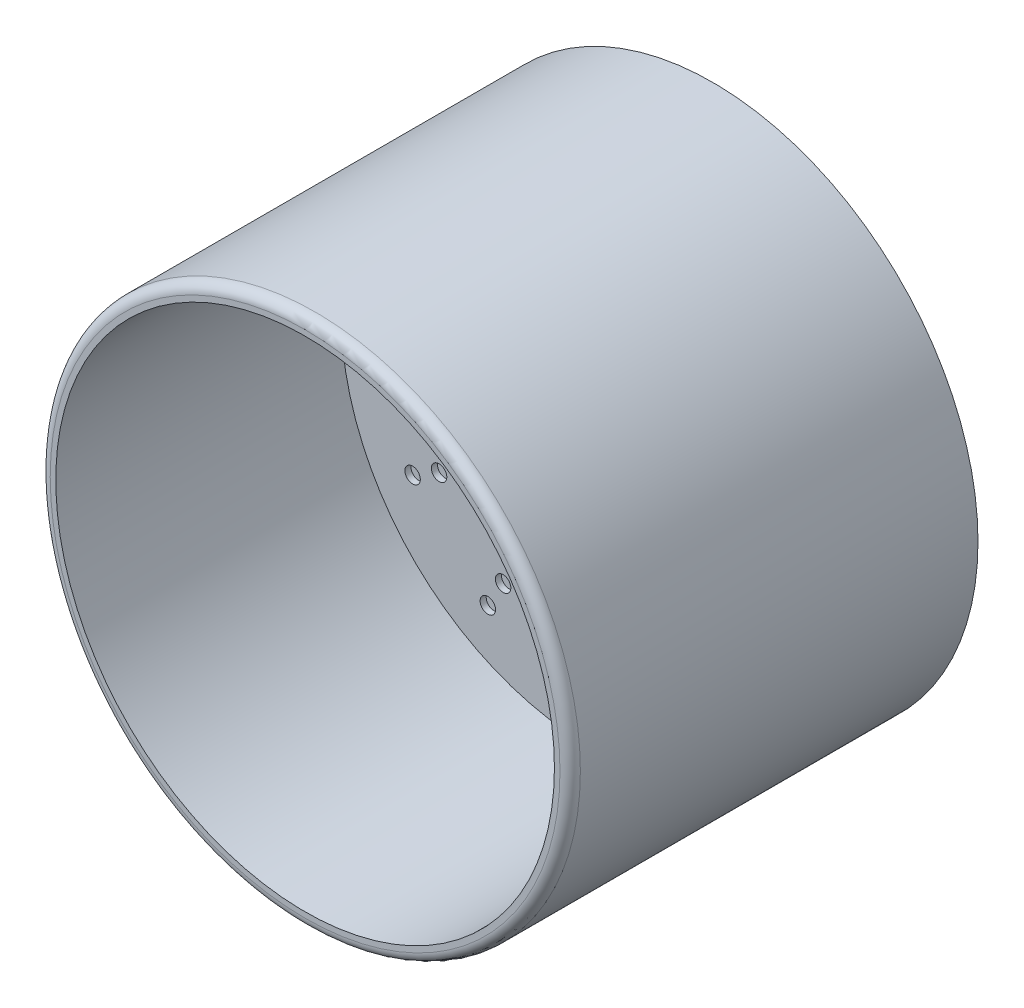
from build123d import *

# Parameters (mm, degrees)
SKETCH1_R           = 13
BOSS_EXTRUDE1_DEPTH = 20
SKETCH2_R           = 12.227815656
CUT_EXTRUDE1_DEPTH  = 14
SKETCH3_R           = 0.378353797
CUT_EXTRUDE2_DEPTH  = 0.3
FILLET1_R           = 0.5


with BuildPart() as part:
    # Sketch1 → Boss-Extrude1 (new body)
    with BuildSketch(Plane.XY):
        Circle(SKETCH1_R)
    extrude(amount=BOSS_EXTRUDE1_DEPTH)

    # Sketch2 → Cut-Extrude1 (cut)
    with BuildSketch(Plane.XY.offset(20)):
        Circle(SKETCH2_R)
    extrude(amount=-CUT_EXTRUDE1_DEPTH, mode=Mode.SUBTRACT)

    # Sketch3 → Cut-Extrude2 (cut)
    with BuildSketch(Plane.XY.offset(6)):
        with Locations((0, 10.077969325)):
            Circle(SKETCH3_R)
        with Locations((0, 8.577969325)):
            Circle(SKETCH3_R)
        with Locations((0, 7.077969325)):
            Circle(SKETCH3_R)
        with Locations((0, 5.577969325)):
            Circle(SKETCH3_R)
        with Locations((0, 4.077969325)):
            Circle(SKETCH3_R)
        with Locations((0, 2.577969325)):
            Circle(SKETCH3_R)
        with Locations((5.038984662, 8.727777454)):
            Circle(SKETCH3_R)
        with Locations((4.288984662, 7.428739348)):
            Circle(SKETCH3_R)
        with Locations((3.538984662, 6.129701243)):
            Circle(SKETCH3_R)
        with Locations((2.788984662, 4.830663137)):
            Circle(SKETCH3_R)
        with Locations((2.038984662, 3.531625031)):
            Circle(SKETCH3_R)
        with Locations((1.288984662, 2.232586926)):
            Circle(SKETCH3_R)
        with Locations((8.727777454, 5.038984662)):
            Circle(SKETCH3_R)
        with Locations((7.428739348, 4.288984662)):
            Circle(SKETCH3_R)
        with Locations((6.129701243, 3.538984662)):
            Circle(SKETCH3_R)
        with Locations((4.830663137, 2.788984662)):
            Circle(SKETCH3_R)
        with Locations((3.531625031, 2.038984662)):
            Circle(SKETCH3_R)
        with Locations((2.232586926, 1.288984662)):
            Circle(SKETCH3_R)
        with Locations((10.077969325, 0)):
            Circle(SKETCH3_R)
        with Locations((8.577969325, 0)):
            Circle(SKETCH3_R)
        with Locations((7.077969325, 0)):
            Circle(SKETCH3_R)
        with Locations((5.577969325, 0)):
            Circle(SKETCH3_R)
        with Locations((4.077969325, 0)):
            Circle(SKETCH3_R)
        with Locations((2.577969325, 0)):
            Circle(SKETCH3_R)
        with Locations((8.727777454, -5.038984662)):
            Circle(SKETCH3_R)
        with Locations((7.428739348, -4.288984662)):
            Circle(SKETCH3_R)
        with Locations((6.129701243, -3.538984662)):
            Circle(SKETCH3_R)
        with Locations((4.830663137, -2.788984662)):
            Circle(SKETCH3_R)
        with Locations((3.531625031, -2.038984662)):
            Circle(SKETCH3_R)
        with Locations((2.232586926, -1.288984662)):
            Circle(SKETCH3_R)
        with Locations((5.038984662, -8.727777454)):
            Circle(SKETCH3_R)
        with Locations((4.288984662, -7.428739348)):
            Circle(SKETCH3_R)
        with Locations((3.538984662, -6.129701243)):
            Circle(SKETCH3_R)
        with Locations((2.788984662, -4.830663137)):
            Circle(SKETCH3_R)
        with Locations((2.038984662, -3.531625031)):
            Circle(SKETCH3_R)
        with Locations((1.288984662, -2.232586926)):
            Circle(SKETCH3_R)
        with Locations((0, -10.077969325)):
            Circle(SKETCH3_R)
        with Locations((0, -8.577969325)):
            Circle(SKETCH3_R)
        with Locations((0, -7.077969325)):
            Circle(SKETCH3_R)
        with Locations((0, -5.577969325)):
            Circle(SKETCH3_R)
        with Locations((0, -4.077969325)):
            Circle(SKETCH3_R)
        with Locations((0, -2.577969325)):
            Circle(SKETCH3_R)
        with Locations((-5.038984662, -8.727777454)):
            Circle(SKETCH3_R)
        with Locations((-4.288984662, -7.428739348)):
            Circle(SKETCH3_R)
        with Locations((-3.538984662, -6.129701243)):
            Circle(SKETCH3_R)
        with Locations((-2.788984662, -4.830663137)):
            Circle(SKETCH3_R)
        with Locations((-2.038984662, -3.531625031)):
            Circle(SKETCH3_R)
        with Locations((-1.288984662, -2.232586926)):
            Circle(SKETCH3_R)
        with Locations((-8.727777454, -5.038984662)):
            Circle(SKETCH3_R)
        with Locations((-7.428739348, -4.288984662)):
            Circle(SKETCH3_R)
        with Locations((-6.129701243, -3.538984662)):
            Circle(SKETCH3_R)
        with Locations((-4.830663137, -2.788984662)):
            Circle(SKETCH3_R)
        with Locations((-3.531625031, -2.038984662)):
            Circle(SKETCH3_R)
        with Locations((-2.232586926, -1.288984662)):
            Circle(SKETCH3_R)
        with Locations((-10.077969325, 0)):
            Circle(SKETCH3_R)
        with Locations((-8.577969325, 0)):
            Circle(SKETCH3_R)
        with Locations((-7.077969325, 0)):
            Circle(SKETCH3_R)
        with Locations((-5.577969325, 0)):
            Circle(SKETCH3_R)
        with Locations((-4.077969325, 0)):
            Circle(SKETCH3_R)
        with Locations((-2.577969325, 0)):
            Circle(SKETCH3_R)
        with Locations((-8.727777454, 5.038984662)):
            Circle(SKETCH3_R)
        with Locations((-7.428739348, 4.288984662)):
            Circle(SKETCH3_R)
        with Locations((-6.129701243, 3.538984662)):
            Circle(SKETCH3_R)
        with Locations((-4.830663137, 2.788984662)):
            Circle(SKETCH3_R)
        with Locations((-3.531625031, 2.038984662)):
            Circle(SKETCH3_R)
        with Locations((-2.232586926, 1.288984662)):
            Circle(SKETCH3_R)
        with Locations((-5.038984662, 8.727777454)):
            Circle(SKETCH3_R)
        with Locations((-4.288984662, 7.428739348)):
            Circle(SKETCH3_R)
        with Locations((-3.538984662, 6.129701243)):
            Circle(SKETCH3_R)
        with Locations((-2.788984662, 4.830663137)):
            Circle(SKETCH3_R)
        with Locations((-2.038984662, 3.531625031)):
            Circle(SKETCH3_R)
        with Locations((-1.288984662, 2.232586926)):
            Circle(SKETCH3_R)
    extrude(amount=-CUT_EXTRUDE2_DEPTH, mode=Mode.SUBTRACT)

    # Fillet1
    fillet1_edges = [part.edges().sort_by_distance(p)[0] for p in [
        (-13, 0, 20),
    ]]
    fillet(fillet1_edges, radius=FILLET1_R)


solid = part.part
